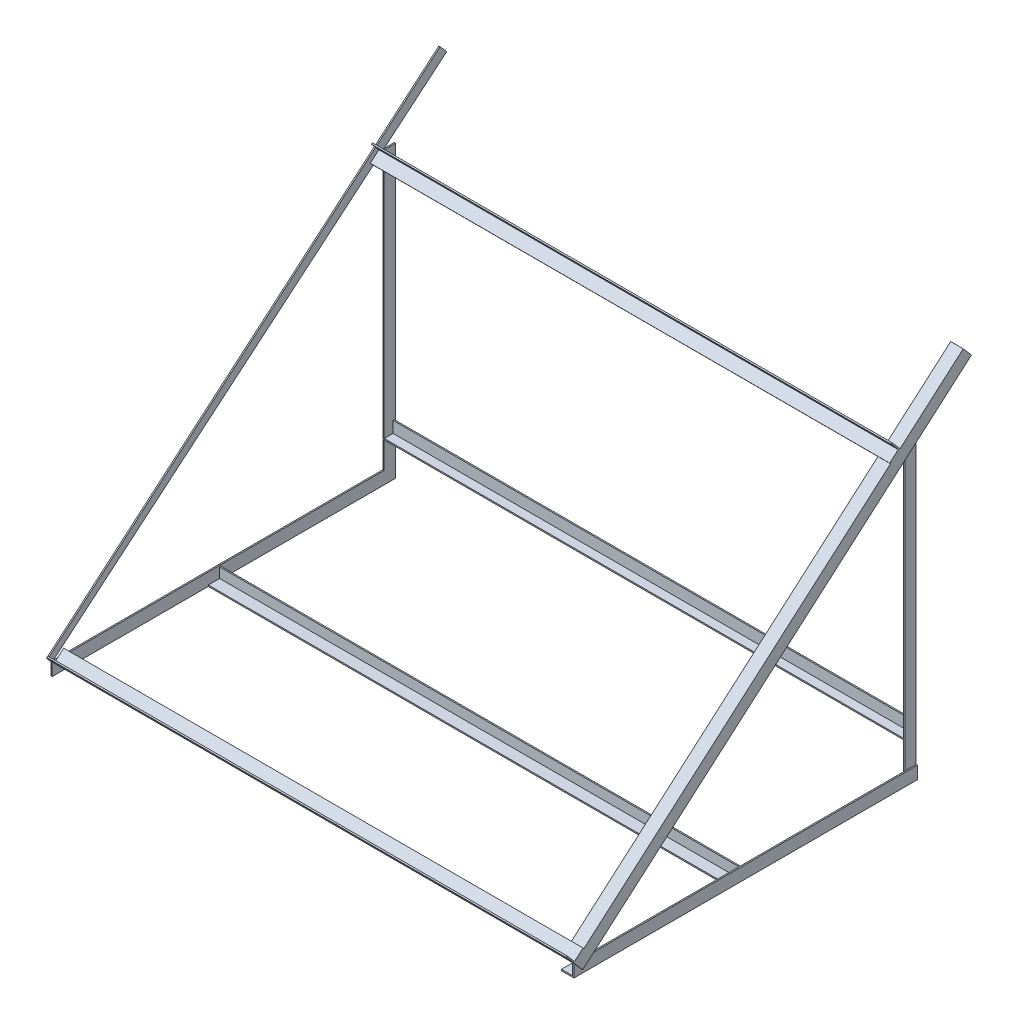
from build123d import *

# Parameters (mm, degrees)
EXTRUDE_1_DEPTH  = 820
EXTRUDE_2_DEPTH  = 690
EXTRUDE_6_DEPTH  = 1230
EXTRUDE_7_DEPTH  = 1240
EXTRUDE_9_DEPTH  = 1240
EXTRUDE_11_DEPTH = 1240
EXTRUDE_12_DEPTH = 1240
EXTRUDE_13_DEPTH = 3
EXTRUDE_14_DEPTH = 3


with BuildPart() as part:
    # 草圖1 → 填料-伸長1 (new body)
    with BuildSketch(Plane.XY):
        Polygon((-30, 0), (0, 0), (0, 30), (-3, 30), (-3, 3), (-30, 3), align=None)
    extrude(amount=-EXTRUDE_1_DEPTH)

    # 草圖2 → 填料-伸長2 (add)
    with BuildSketch(Plane(origin=(0, 3, 0), x_dir=(1, 0, 0), z_dir=(0, 1, 0))):
        Polygon((-30, 820), (-3, 820), (-3, 793), (-6, 793), (-6, 817), (-30, 817), align=None)
    extrude(amount=EXTRUDE_2_DEPTH)


with BuildPart() as body_2:
    # 草圖5 → 填料-伸長6 (new body)
    with BuildSketch(Plane(origin=(0, 12.912403486, -14.854021031), x_dir=(-1, 0, 0), z_dir=(0, -0.6560590289905112, 0.7547095802227686))):
        Polygon((3, -22.641287407), (27, -22.641287407), (27, -25.641287407), (-3, -25.641287407), (-3, 4.358712593), (0, 4.358712593), (0, -22.641287407), align=None)
    extrude(amount=-EXTRUDE_6_DEPTH)

    # 草圖7 → 填料-伸長7 (add)
    with BuildSketch(Plane(origin=(3, 0, 0), x_dir=(0, 0, -1), z_dir=(1, 0, 0))):
        Polygon((-1.968177087, 32.264128741), (-21.649947957, 54.905416147), (-19.385819216, 56.873593234), (-1.672225433, 36.496434568), (18.704933233, 54.210028351), (20.67311032, 51.94589961), align=None)
    extrude(amount=-EXTRUDE_7_DEPTH)

    # 草圖10 → 填料-伸長12 (add)
    with BuildSketch(Plane(origin=(3, 0, 0), x_dir=(0, 0, -1), z_dir=(1, 0, 0))):
        Polygon((752.741403136, 688.323157731), (775.382690542, 708.004928601), (755.700919673, 730.646216008), (753.436790932, 728.678038921), (771.150384715, 708.300880255), (750.773226049, 690.587286472), align=None)
    extrude(amount=-EXTRUDE_12_DEPTH)


with BuildPart() as body_3:
    # 草圖8 → 填料-伸長9 (new body)
    with BuildSketch(Plane.ZY.offset(3)):
        Polygon((-400, 3), (-400, 30), (-397, 30), (-397, 6), (-370, 6), (-370, 3), align=None)
    extrude(amount=EXTRUDE_9_DEPTH)


with BuildPart() as body_4:
    # 草圖9 → 填料-伸長11 (new body)
    with BuildSketch(Plane.ZY.offset(6)):
        Polygon((-793, 93), (-817, 93), (-817, 123), (-814, 123), (-814, 96), (-793, 96), align=None)
    extrude(amount=EXTRUDE_11_DEPTH)

    # 草圖12 → 填料-伸長13 (add)
    with BuildSketch(Plane.ZY.offset(1246)):
        Polygon((0, 0), (-820, 0), (-820, 693), (-793, 693), (-793, 30), (0, 30), align=None)
    extrude(amount=EXTRUDE_13_DEPTH)


with BuildPart() as body_5:
    # 草圖13 → 填料-伸長14 (new body)
    with BuildSketch(Plane(origin=(-1246, 0, 0), x_dir=(0, 0, -1), z_dir=(1, 0, 0))):
        Polygon((0, 30), (942.105076275, 821.063380618), (926.324606587, 839.216734399), (-10.193106927, 41.72582818), align=None)
    extrude(amount=-EXTRUDE_14_DEPTH)


solid = Compound([part.part, body_2.part, body_3.part, body_4.part, body_5.part])
